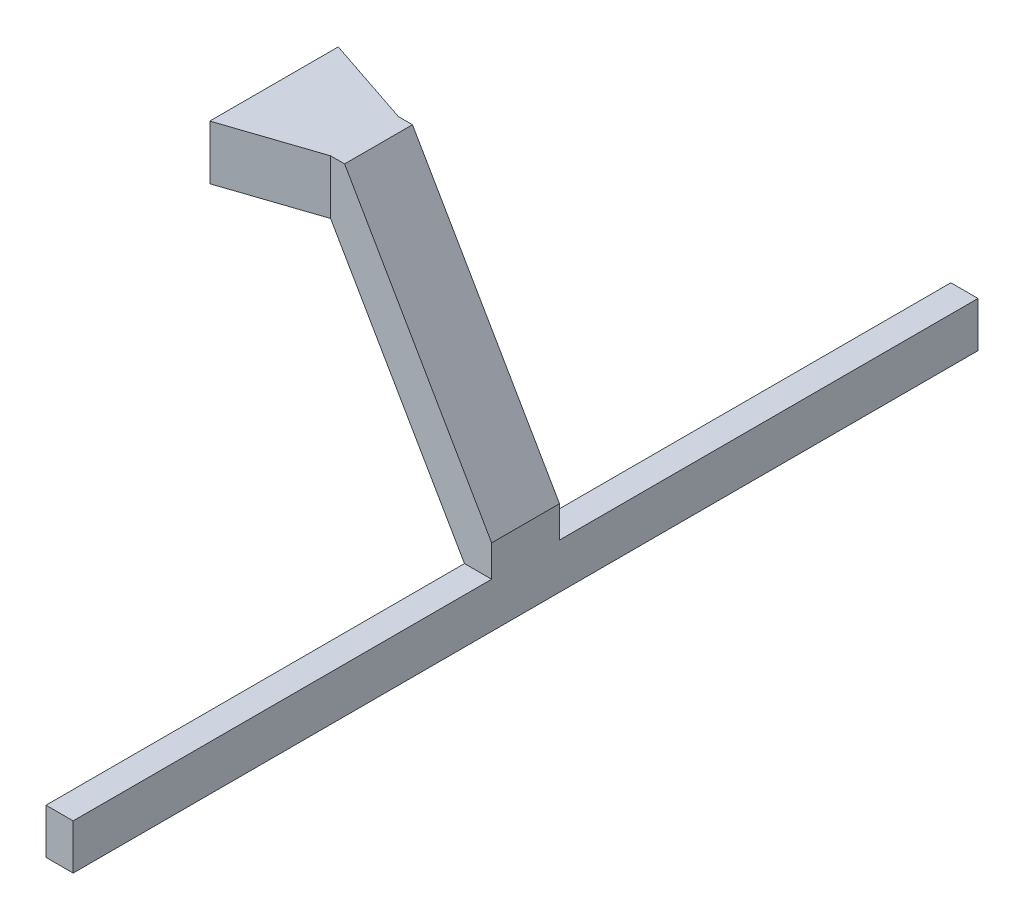
from build123d import *

# Parameters (mm, degrees)
BOSS_EXTRU_1_DEPTH = 15
ESQUISSE5_W        = 200
ESQUISSE5_H        = 10
BOSS_EXTRU_4_DEPTH = 6
BOSS_EXTRU_5_DEPTH = 12
BOSS_EXTRU_6_DEPTH = 12


with BuildPart() as part:
    # Esquisse1 → Boss.-Extru.1 (new body)
    with BuildSketch(Plane.XY):
        Polygon((-29.902548443, 15.22370444), (-6.802548443, 15.22370444), (25.697451557, -41.067946806), (25.697451557, -58.033349019), (19.697451557, -58.033349019), (19.697451557, -48.033349019), (-9.895822056, 3.22370444), (-29.902548443, 3.22370444), align=None)
    extrude(amount=BOSS_EXTRU_1_DEPTH)

    # Esquisse5 → Boss.-Extru.4 (add)
    with BuildSketch(Plane(origin=(25.697451557, 0, 0), x_dir=(0, 0, -1), z_dir=(1, 0, 0))):
        with Locations((-7.5, -53.033349019)):
            Rectangle(ESQUISSE5_W, ESQUISSE5_H)
    extrude(amount=-BOSS_EXTRU_4_DEPTH)

    # Esquisse6 → Boss.-Extru.5 (add)
    with BuildSketch(Plane(origin=(0, 15.22370444, 0), x_dir=(1, 0, 0), z_dir=(0, 1, 0))):
        Polygon((-29.902548443, -15), (-9.895822056, -15), (-29.902548443, -21.702554703), align=None)
    extrude(amount=-BOSS_EXTRU_5_DEPTH)

    # Esquisse7 → Boss.-Extru.6 (add)
    with BuildSketch(Plane(origin=(0, 15.22370444, 0), x_dir=(1, 0, 0), z_dir=(0, 1, 0))):
        Polygon((-29.902548443, 0), (-9.895822056, 0), (-29.902548443, 6.692394801), align=None)
    extrude(amount=-BOSS_EXTRU_6_DEPTH)


solid = part.part
